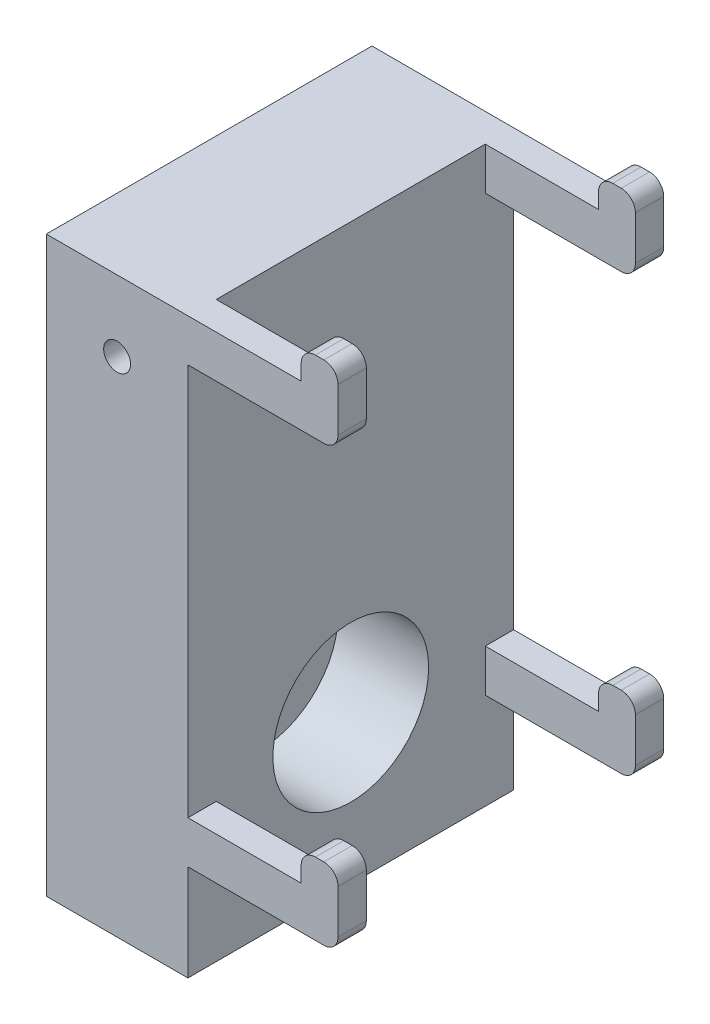
from build123d import *

# Parameters (mm, degrees)
SKETCH1_W                                         = 23
SKETCH1_H                                         = 40.5
BOSS_EXTRUDE1_DEPTH                               = 10
CHAMBRAGE_POUR_VIS_SIX_PANS_CREUX_M61_D           = 6.6
CHAMBRAGE_POUR_VIS_SIX_PANS_CREUX_M61_CBORE_D     = 11
CHAMBRAGE_POUR_VIS_SIX_PANS_CREUX_M61_CBORE_DEPTH = 6.4
BOSS_EXTRUDE2_DEPTH                               = 2
ESQUISSE5_R                                       = 0.95
ENL_V_MAT_EXTRU_1_DEPTH                           = 4


with BuildPart() as part:
    # Sketch1 → Boss-Extrude1 (new body)
    with BuildSketch(Plane(origin=(0, 0, 0), x_dir=(0, 0, -1), z_dir=(1, 0, 0))):
        with Locations((0, -20.25)):
            Rectangle(SKETCH1_W, SKETCH1_H)
    extrude(amount=BOSS_EXTRUDE1_DEPTH)

    # Chambrage pour vis à six pans creux M61 (through all)
    with Locations(Plane(origin=(10, 0, 0), x_dir=(0, 0, -1), z_dir=(1, 0, 0))):
        with Locations((0, -30)):
            CounterBoreHole(CHAMBRAGE_POUR_VIS_SIX_PANS_CREUX_M61_D / 2, CHAMBRAGE_POUR_VIS_SIX_PANS_CREUX_M61_CBORE_D / 2, CHAMBRAGE_POUR_VIS_SIX_PANS_CREUX_M61_CBORE_DEPTH)

    # Sketch4 → Boss-Extrude2 (add)
    with BuildSketch(Plane.XY.offset(11.5)):
        with BuildLine():
            Line((10, 0), (18, 0))
            Line((18, 0), (18, 1.1))
            ThreePointArc((18, 1.1), (18.292893219, 1.807106781), (19, 2.1))
            Line((19, 2.1), (19.6, 2.1))
            ThreePointArc((19.6, 2.1), (20.307106781, 1.807106781), (20.6, 1.1))
            Line((20.6, 1.1), (20.6, -2))
            ThreePointArc((20.6, -2), (20.307106781, -2.707106781), (19.6, -3))
            Line((19.6, -3), (10, -3))
            Line((10, -3), (10, 0))
        make_face()
        with BuildLine():
            Line((10, -30.7), (18, -30.7))
            Line((18, -30.7), (18, -29.6))
            ThreePointArc((18, -29.6), (18.292893219, -28.892893219), (19, -28.6))
            Line((19, -28.6), (19.6, -28.6))
            ThreePointArc((19.6, -28.6), (20.307106781, -28.892893219), (20.6, -29.6))
            Line((20.6, -29.6), (20.6, -32.7))
            ThreePointArc((20.6, -32.7), (20.307106781, -33.407106781), (19.6, -33.7))
            Line((19.6, -33.7), (10, -33.7))
            Line((10, -33.7), (10, -30.7))
        make_face()
    boss_extrude2 = extrude(amount=-BOSS_EXTRUDE2_DEPTH)

    # Mirror1: Boss-Extrude2 across plane
    add(boss_extrude2.mirror(Plane.XY))

    # Esquisse5 → Enlèv. mat.-Extru.1 (cut)
    with BuildSketch(Plane.XY.offset(11.5)):
        with Locations((5, -5)):
            Circle(ESQUISSE5_R)
    enl_v_mat_extru_1 = extrude(amount=-ENL_V_MAT_EXTRU_1_DEPTH, mode=Mode.SUBTRACT)

    # Symétrie1: Enlèv. mat.-Extru.1 across plane
    add(enl_v_mat_extru_1.mirror(Plane.XY), mode=Mode.SUBTRACT)


solid = part.part
